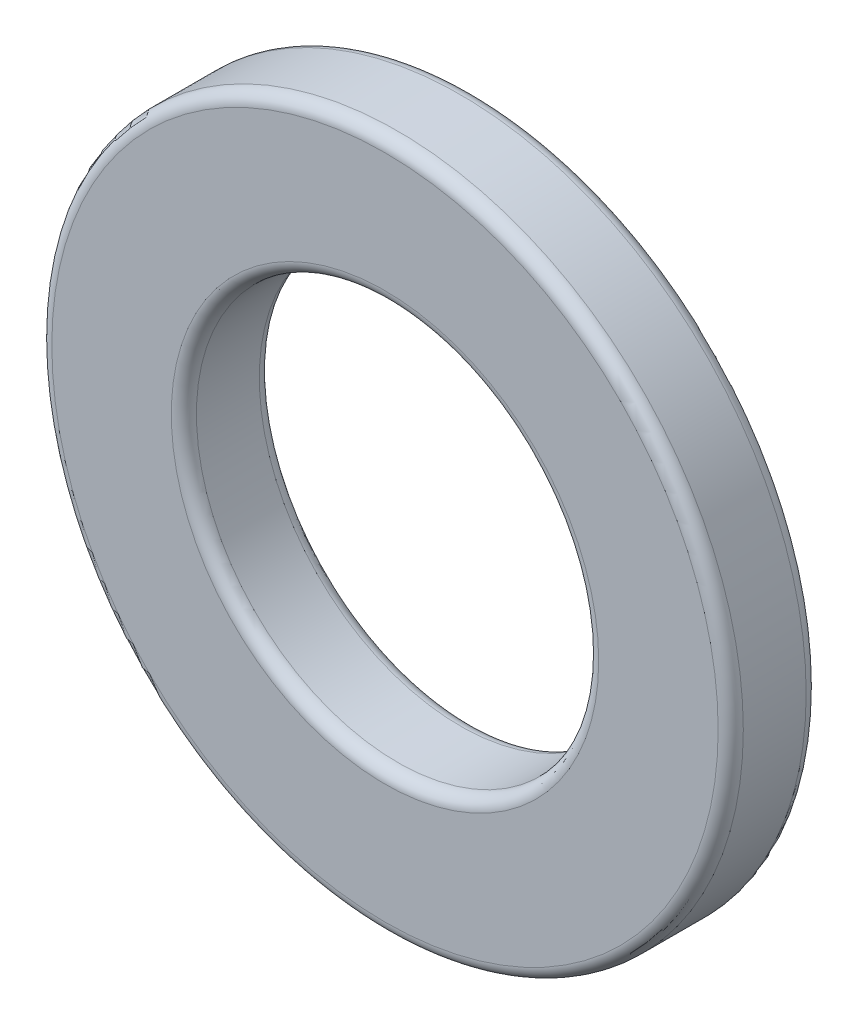
from build123d import *

# Parameters (mm, degrees)
SKETCH1_R           = 1.375
SKETCH1_R_2         = 0.8
BOSS_EXTRUDE1_DEPTH = 0.35
FILLET1_R           = 0.05


with BuildPart() as part:
    # Sketch1 → Boss-Extrude1 (new body)
    with BuildSketch(Plane.XY):
        Circle(SKETCH1_R)
        Circle(SKETCH1_R_2, mode=Mode.SUBTRACT)
    extrude(amount=BOSS_EXTRUDE1_DEPTH)

    # Fillet1
    fillet1_edges = [part.edges().sort_by_distance(p)[0] for p in [
        (-1.375, 0, 0),
        (-1.375, 0, 0.35),
        (-0.8, 0, 0),
        (-0.8, 0, 0.35),
    ]]
    fillet(fillet1_edges, radius=FILLET1_R)


solid = part.part
